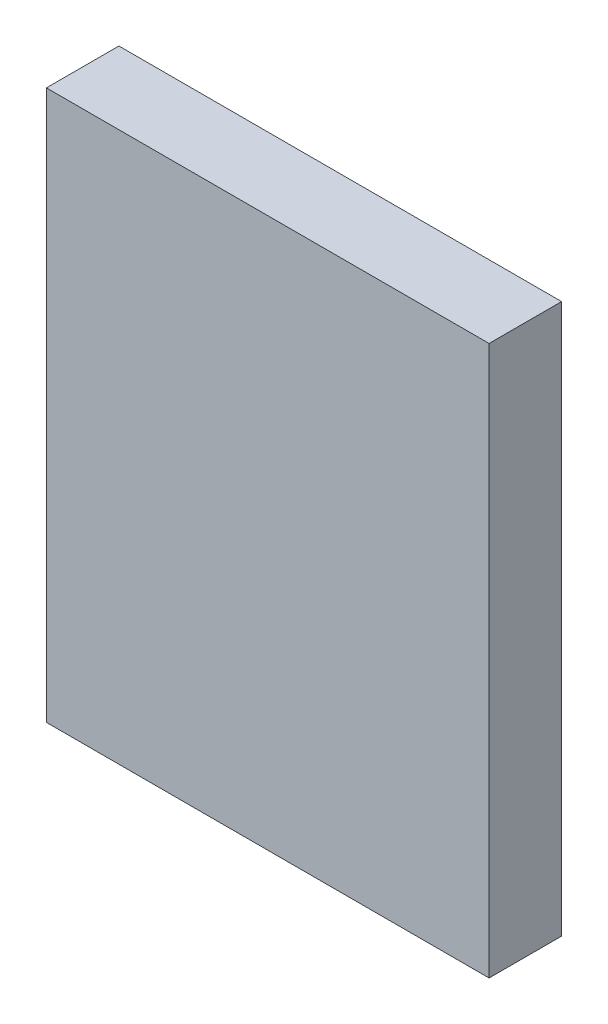
from build123d import *

# Parameters (mm, degrees)
ESQUISSE1_W        = 29
ESQUISSE1_H        = 36
BOSS_EXTRU_1_DEPTH = 4.75


with BuildPart() as part:
    # Esquisse1 → Boss.-Extru.1 (new body)
    with BuildSketch(Plane.XY):
        with Locations((0.196553852, -4.981182796)):
            Rectangle(ESQUISSE1_W, ESQUISSE1_H)
    extrude(amount=BOSS_EXTRU_1_DEPTH)


solid = part.part
